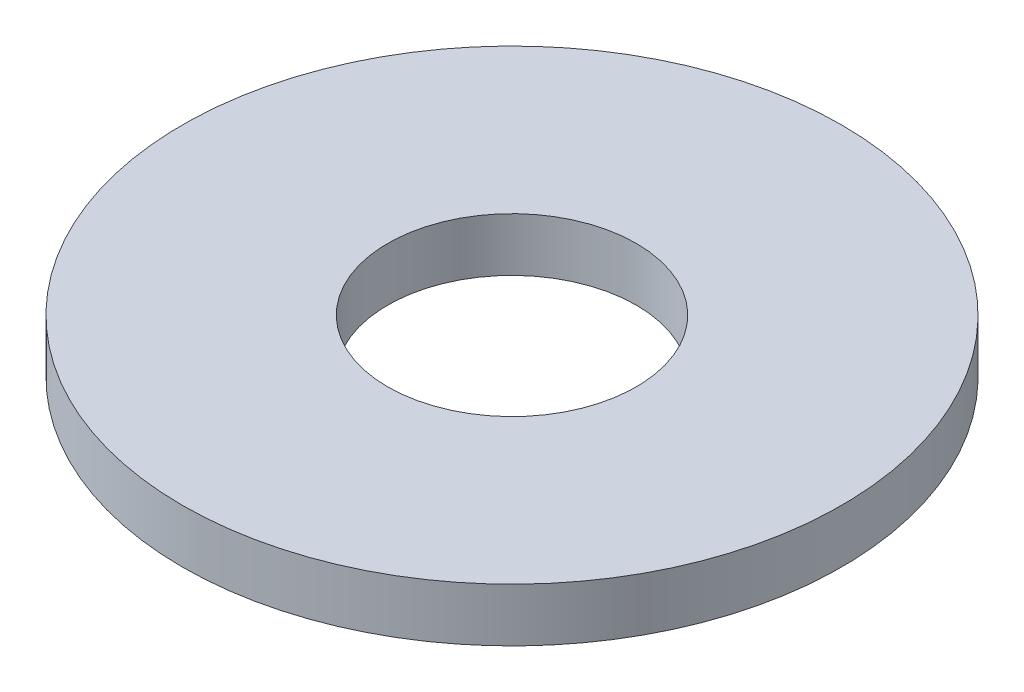
from build123d import *

# Parameters (mm, degrees)
SKETCH1_R           = 11.1125
SKETCH1_R_2         = 4.191
BOSS_EXTRUDE1_DEPTH = 1.8034


with BuildPart() as part:
    # Sketch1 → Boss-Extrude1 (new body)
    with BuildSketch(Plane(origin=(0, 0, 0), x_dir=(1, 0, 0), z_dir=(0, 1, 0))):
        with Locations(Location((0, 0, 0), (0, 0, 270))):
            Circle(SKETCH1_R)
        with Locations(Location((0, 0, 0), (0, 0, 270))):
            Circle(SKETCH1_R_2, mode=Mode.SUBTRACT)
    extrude(amount=BOSS_EXTRUDE1_DEPTH)


solid = part.part
